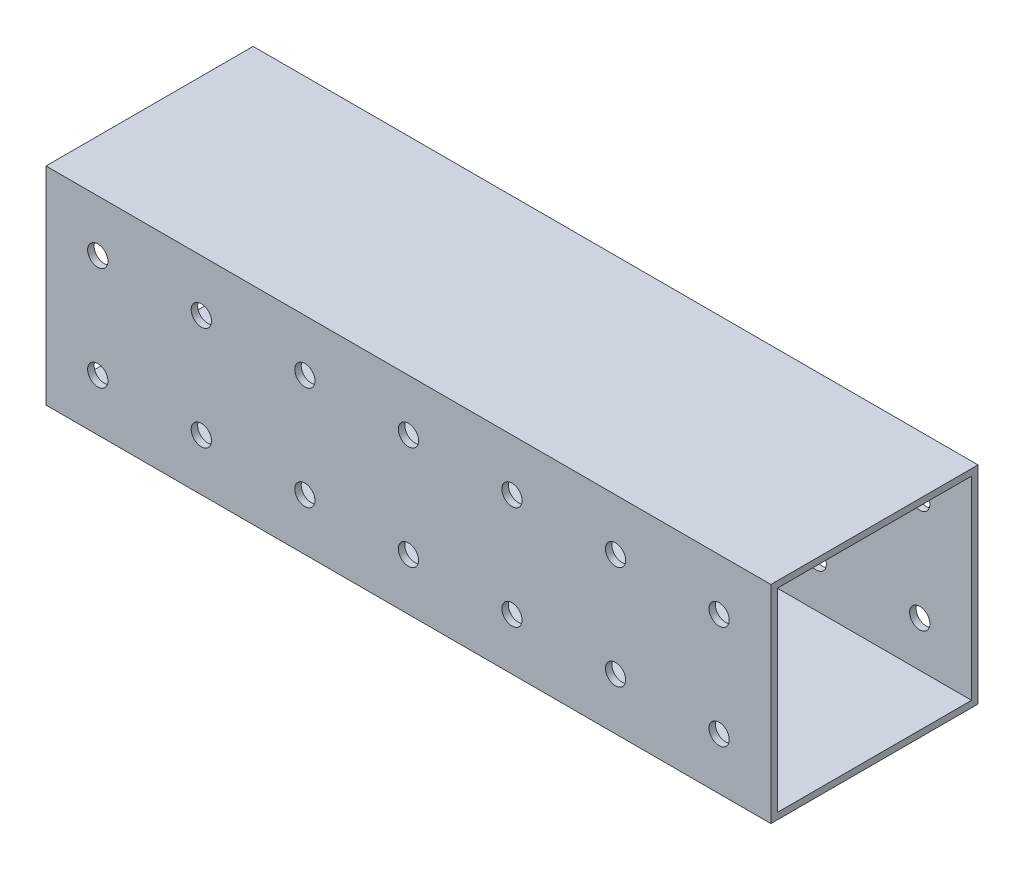
from build123d import *

# Parameters (mm, degrees)
SKETCH1_W           = 50.8
SKETCH1_H           = 50.8
BOSS_EXTRUDE1_DEPTH = 177.8
SHELL1_T            = -1.5875
SKETCH2_R           = 2.4892
CUT_EXTRUDE1_DEPTH  = 192.765794656
LPATTERN1_COUNT     = 7
LPATTERN1_PITCH     = 25.4


with BuildPart() as part:
    # Sketch1 → Boss-Extrude1 (new body)
    with BuildSketch(Plane(origin=(0, 0, 0), x_dir=(0, 0, -1), z_dir=(1, 0, 0))):
        with Locations((25.4, 25.4)):
            Rectangle(SKETCH1_W, SKETCH1_H)
    extrude(amount=BOSS_EXTRUDE1_DEPTH)

    # Shell1
    shell1_openings = [part.faces().sort_by_distance(p)[0] for p in [
        (177.8, 25.4, -25.4),
        (0, 25.4, -25.4),
    ]]
    offset(amount=SHELL1_T, openings=shell1_openings, kind=Kind.INTERSECTION)

    # Sketch2 → Cut-Extrude1 (cut, through all)
    with BuildSketch(Plane(origin=(0, 0, -50.8), x_dir=(-1, 0, 0), z_dir=(0, 0, -1))):
        with Locations((-12.7, 12.7)):
            Circle(SKETCH2_R)
        with Locations((-12.7, 38.1)):
            Circle(SKETCH2_R)
    cut_extrude1 = extrude(amount=-CUT_EXTRUDE1_DEPTH, mode=Mode.SUBTRACT)

    # LPattern1: Cut-Extrude1 ×7
    with Locations(*[(i * LPATTERN1_PITCH, 0, 0) for i in range(1, LPATTERN1_COUNT)]):
        add(cut_extrude1, mode=Mode.SUBTRACT)


solid = part.part
